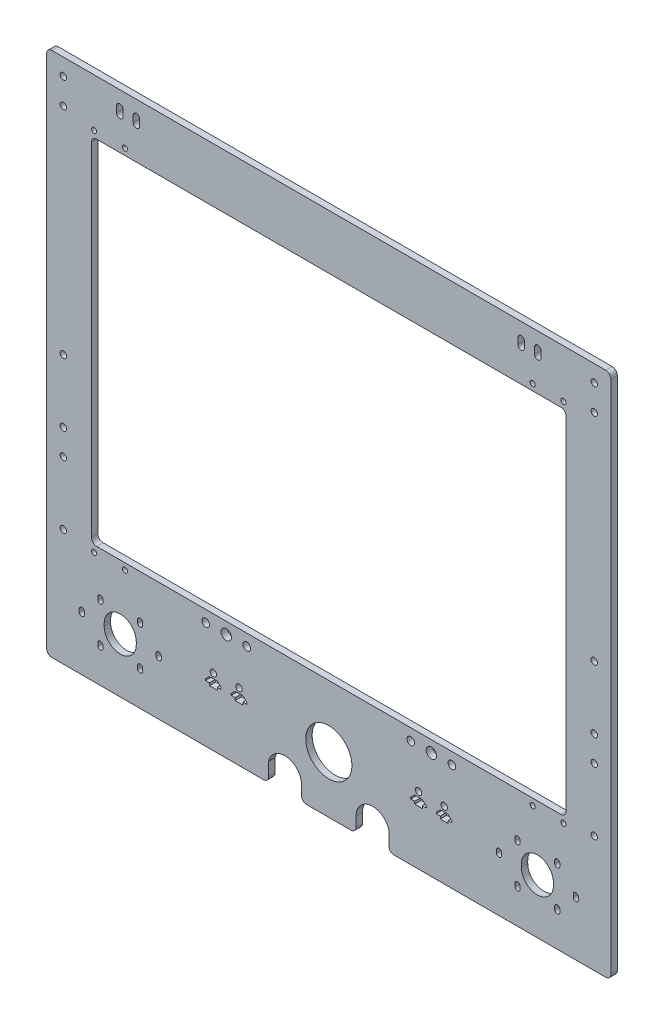
from build123d import *

# Parameters (mm, degrees)
SKETCH1_R           = 2.5
SKETCH1_R_2         = 18
SKETCH1_R_3         = 4.05
SKETCH1_R_4         = 3
SKETCH1_R_5         = 2
SKETCH1_R_6         = 12.5
BOSS_EXTRUDE1_DEPTH = 5
CUT_EXTRUDE1_DEPTH  = 14
CUT_EXTRUDE2_START  = -14
CUT_EXTRUDE2_DEPTH  = 14
FILLET1_R           = 4
CUT_EXTRUDE3_DEPTH  = 10
SKETCH7_R           = 2.5
CUT_EXTRUDE4_DEPTH  = 10


with BuildPart() as part:
    # Sketch1 → Boss-Extrude1 (new body)
    with BuildSketch(Plane(origin=(0, 0, 0), x_dir=(-1, 0, 0), z_dir=(0, 0, -1))):
        with BuildLine():
            Line((317.464038659, -305.743304357), (317.464038659, 96.256695643))
            ThreePointArc((317.464038659, 96.256695643), (316.292465784, 99.085122768), (313.464038659, 100.256695643))
            Line((313.464038659, 100.256695643), (-118.535961341, 100.256695643))
            ThreePointArc((-118.535961341, 100.256695643), (-121.364388466, 99.085122768), (-122.535961341, 96.256695643))
            Line((-122.535961341, 96.256695643), (-122.535961341, -305.743304357))
            ThreePointArc((-122.535961341, -305.743304357), (-121.364388466, -308.571731482), (-118.535961341, -309.743304357))
            Line((-118.535961341, -309.743304357), (313.464038659, -309.743304357))
            ThreePointArc((313.464038659, -309.743304357), (316.292465784, -308.571731482), (317.464038659, -305.743304357))
        make_face()
        with Locations(Location((304.464038659, 87.256695643, 0), (0, 0, 180))):
            Circle(SKETCH1_R, mode=Mode.SUBTRACT)
        with Locations(Location((304.464038659, 67.256695643, 0), (0, 0, 180))):
            Circle(SKETCH1_R, mode=Mode.SUBTRACT)
        with Locations(Location((304.464038659, -149.743304357, 0), (0, 0, 180))):
            Circle(SKETCH1_R, mode=Mode.SUBTRACT)
        with Locations(Location((304.464038659, -169.743304357, 0), (0, 0, 180))):
            Circle(SKETCH1_R, mode=Mode.SUBTRACT)
        with Locations(Location((-109.535961341, 87.256695643, 0), (0, 0, 180))):
            Circle(SKETCH1_R, mode=Mode.SUBTRACT)
        with Locations(Location((-109.535961341, 67.256695643, 0), (0, 0, 180))):
            Circle(SKETCH1_R, mode=Mode.SUBTRACT)
        with Locations(Location((-109.535961341, -149.743304357, 0), (0, 0, 180))):
            Circle(SKETCH1_R, mode=Mode.SUBTRACT)
        with Locations(Location((-109.535961341, -169.743304357, 0), (0, 0, 180))):
            Circle(SKETCH1_R, mode=Mode.SUBTRACT)
        with Locations(Location((7.464038659, -257.243304357, 0), (0, 0, 180))):
            Circle(SKETCH1_R, mode=Mode.SUBTRACT)
        with Locations(Location((27.464038659, -257.243304357, 0), (0, 0, 180))):
            Circle(SKETCH1_R, mode=Mode.SUBTRACT)
        with Locations(Location((167.464038659, -257.243304357, 0), (0, 0, 180))):
            Circle(SKETCH1_R, mode=Mode.SUBTRACT)
        with Locations(Location((187.464038659, -257.243304357, 0), (0, 0, 180))):
            Circle(SKETCH1_R, mode=Mode.SUBTRACT)
        with Locations(Location((97.464038659, -265.743304357, 0), (0, 0, 180))):
            Circle(SKETCH1_R_2, mode=Mode.SUBTRACT)
        with Locations(Location((17.464038659, -226.243304357, 0), (0, 0, 180))):
            Circle(SKETCH1_R_3, mode=Mode.SUBTRACT)
        with Locations(Location((161.464038659, -226.243304357, 0), (0, 0, 180))):
            Circle(SKETCH1_R_4, mode=Mode.SUBTRACT)
        with Locations(Location((33.464038659, -226.243304357, 0), (0, 0, 180))):
            Circle(SKETCH1_R_4, mode=Mode.SUBTRACT)
        with Locations(Location((1.464038659, -226.243304357, 0), (0, 0, 180))):
            Circle(SKETCH1_R_4, mode=Mode.SUBTRACT)
        with Locations(Location((177.464038659, -226.243304357, 0), (0, 0, 180))):
            Circle(SKETCH1_R_3, mode=Mode.SUBTRACT)
        with Locations(Location((193.464038659, -226.243304357, 0), (0, 0, 180))):
            Circle(SKETCH1_R_4, mode=Mode.SUBTRACT)
        with Locations(Location((-85.535961341, 62.756695643, 0), (0, 0, 180))):
            Circle(SKETCH1_R_5, mode=Mode.SUBTRACT)
        with Locations(Location((-61.535961341, 62.756695643, 0), (0, 0, 180))):
            Circle(SKETCH1_R_5, mode=Mode.SUBTRACT)
        with Locations(Location((256.464038659, 62.756695643, 0), (0, 0, 180))):
            Circle(SKETCH1_R_5, mode=Mode.SUBTRACT)
        with Locations(Location((280.464038659, 62.756695643, 0), (0, 0, 180))):
            Circle(SKETCH1_R_5, mode=Mode.SUBTRACT)
        with Locations(Location((-85.535961341, -222.243304357, 0), (0, 0, 180))):
            Circle(SKETCH1_R_5, mode=Mode.SUBTRACT)
        with Locations(Location((-61.535961341, -222.243304357, 0), (0, 0, 180))):
            Circle(SKETCH1_R_5, mode=Mode.SUBTRACT)
        with Locations(Location((256.464038659, -222.243304357, 0), (0, 0, 180))):
            Circle(SKETCH1_R_5, mode=Mode.SUBTRACT)
        with Locations(Location((280.464038659, -222.243304357, 0), (0, 0, 180))):
            Circle(SKETCH1_R_5, mode=Mode.SUBTRACT)
        with Locations(Location((-65.185961341, -266.243304357, 0), (0, 0, 180))):
            Circle(SKETCH1_R_6, mode=Mode.SUBTRACT)
        with Locations(Location((-80.685961341, -250.743304357, 0), (0, 0, 180))):
            Circle(SKETCH1_R_5, mode=Mode.SUBTRACT)
        with Locations(Location((-49.685961341, -250.743304357, 0), (0, 0, 180))):
            Circle(SKETCH1_R_5, mode=Mode.SUBTRACT)
        with Locations(Location((-49.685961341, -281.743304357, 0), (0, 0, 180))):
            Circle(SKETCH1_R_5, mode=Mode.SUBTRACT)
        with Locations(Location((-80.685961341, -281.743304357, 0), (0, 0, 180))):
            Circle(SKETCH1_R_5, mode=Mode.SUBTRACT)
        with Locations((290.114038659, -266.243304357)):
            Circle(SKETCH1_R_5, mode=Mode.SUBTRACT)
        with Locations((230.114038659, -266.243304357)):
            Circle(SKETCH1_R_5, mode=Mode.SUBTRACT)
        with Locations((275.614038659, -281.743304357)):
            Circle(SKETCH1_R_5, mode=Mode.SUBTRACT)
        with Locations((244.614038659, -281.743304357)):
            Circle(SKETCH1_R_5, mode=Mode.SUBTRACT)
        with Locations((244.614038659, -250.743304357)):
            Circle(SKETCH1_R_5, mode=Mode.SUBTRACT)
        with Locations(Location((-35.185961341, -266.243304357, 0), (0, 0, 180))):
            Circle(SKETCH1_R_5, mode=Mode.SUBTRACT)
        with Locations(Location((-95.185961341, -266.243304357, 0), (0, 0, 180))):
            Circle(SKETCH1_R_5, mode=Mode.SUBTRACT)
        with Locations((275.614038659, -250.743304357)):
            Circle(SKETCH1_R_5, mode=Mode.SUBTRACT)
        with Locations((260.114038659, -266.243304357)):
            Circle(SKETCH1_R_6, mode=Mode.SUBTRACT)
        with BuildLine():
            Line((-83.535961341, 57.756695643), (278.464038659, 57.756695643))
            ThreePointArc((278.464038659, 57.756695643), (281.292465784, 56.585122768), (282.464038659, 53.756695643))
            Line((282.464038659, 53.756695643), (282.464038659, -213.243304357))
            ThreePointArc((282.464038659, -213.243304357), (281.292465784, -216.071731482), (278.464038659, -217.243304357))
            Line((278.464038659, -217.243304357), (-83.535961341, -217.243304357))
            ThreePointArc((-83.535961341, -217.243304357), (-86.364388466, -216.071731482), (-87.535961341, -213.243304357))
            Line((-87.535961341, -213.243304357), (-87.535961341, 53.756695643))
            ThreePointArc((-87.535961341, 53.756695643), (-86.364388466, 56.585122768), (-83.535961341, 57.756695643))
        make_face(mode=Mode.SUBTRACT)
        with BuildLine():
            Line((-68.035961341, 85.756695643), (-68.035961341, 88.256695643))
            ThreePointArc((-68.035961341, 88.256695643), (-65.535961341, 90.756695643), (-63.035961341, 88.256695643))
            Line((-63.035961341, 88.256695643), (-63.035961341, 85.756695643))
            Line((-63.035961341, 85.756695643), (-63.035961341, 83.256695643))
            ThreePointArc((-63.035961341, 83.256695643), (-65.535961341, 80.756695643), (-68.035961341, 83.256695643))
            Line((-68.035961341, 83.256695643), (-68.035961341, 85.756695643))
        make_face(mode=Mode.SUBTRACT)
        with BuildLine():
            Line((-55.035961341, 85.756695643), (-55.035961341, 88.256695643))
            ThreePointArc((-55.035961341, 88.256695643), (-52.535961341, 90.756695643), (-50.035961341, 88.256695643))
            Line((-50.035961341, 88.256695643), (-50.035961341, 85.756695643))
            Line((-50.035961341, 85.756695643), (-50.035961341, 83.256695643))
            ThreePointArc((-50.035961341, 83.256695643), (-52.535961341, 80.756695643), (-55.035961341, 83.256695643))
            Line((-55.035961341, 83.256695643), (-55.035961341, 85.756695643))
        make_face(mode=Mode.SUBTRACT)
        with BuildLine():
            Line((244.964038659, 85.756695643), (244.964038659, 88.256695643))
            ThreePointArc((244.964038659, 88.256695643), (247.464038659, 90.756695643), (249.964038659, 88.256695643))
            Line((249.964038659, 88.256695643), (249.964038659, 85.756695643))
            Line((249.964038659, 85.756695643), (249.964038659, 83.256695643))
            ThreePointArc((249.964038659, 83.256695643), (247.464038659, 80.756695643), (244.964038659, 83.256695643))
            Line((244.964038659, 83.256695643), (244.964038659, 85.756695643))
        make_face(mode=Mode.SUBTRACT)
        with BuildLine():
            Line((257.964038659, 85.756695643), (257.964038659, 88.256695643))
            ThreePointArc((257.964038659, 88.256695643), (260.464038659, 90.756695643), (262.964038659, 88.256695643))
            Line((262.964038659, 88.256695643), (262.964038659, 85.756695643))
            Line((262.964038659, 85.756695643), (262.964038659, 83.256695643))
            ThreePointArc((262.964038659, 83.256695643), (260.464038659, 80.756695643), (257.964038659, 83.256695643))
            Line((257.964038659, 83.256695643), (257.964038659, 85.756695643))
        make_face(mode=Mode.SUBTRACT)
    extrude(amount=-BOSS_EXTRUDE1_DEPTH)

    # Sketch4 → Cut-Extrude1 (cut)
    with BuildSketch(Plane.XY.offset(5)):
        with BuildLine():
            Line((-76.214038659, -298.193304357), (-76.214038659, -309.743304357))
            Line((-76.214038659, -309.743304357), (-50.546953115, -309.743304357))
            Line((-50.546953115, -309.743304357), (-50.546953115, -295.27013077))
            ThreePointArc((-50.546953115, -295.27013077), (-64.685073656, -285.276801114), (-76.214038659, -298.193304357))
        make_face()
        with BuildLine():
            Line((-144.381124203, -295.27013077), (-144.381124203, -309.743304357))
            Line((-144.381124203, -309.743304357), (-118.714038659, -309.743304357))
            Line((-118.714038659, -309.743304357), (-118.714038659, -298.193304357))
            ThreePointArc((-118.714038659, -298.193304357), (-130.243003661, -285.276801114), (-144.381124203, -295.27013077))
        make_face()
    extrude(amount=-CUT_EXTRUDE1_DEPTH, mode=Mode.SUBTRACT)

    # Sketch5 → Cut-Extrude2 (cut)
    with BuildSketch(Plane.XY.offset(5).offset(CUT_EXTRUDE2_START)):
        with BuildLine():
            Line((-273.614038659, -250.743304357), (-273.614038659, -252.743304357))
            ThreePointArc((-273.614038659, -252.743304357), (-275.614038659, -254.743304357), (-277.614038659, -252.743304357))
            Line((-277.614038659, -252.743304357), (-277.614038659, -250.743304357))
            ThreePointArc((-277.614038659, -250.743304357), (-275.614038659, -248.743304357), (-273.614038659, -250.743304357))
        make_face()
        with BuildLine():
            Line((-247.614038659, -266.243304357), (-247.614038659, -268.243304357))
            ThreePointArc((-247.614038659, -268.243304357), (-260.114038659, -280.743304357), (-272.614038659, -268.243304357))
            Line((-272.614038659, -268.243304357), (-272.614038659, -266.243304357))
            ThreePointArc((-272.614038659, -266.243304357), (-260.114038659, -253.743304357), (-247.614038659, -266.243304357))
        make_face()
        with BuildLine():
            Line((-288.114038659, -266.243304357), (-288.114038659, -268.243304357))
            ThreePointArc((-288.114038659, -268.243304357), (-290.114038659, -270.243304357), (-292.114038659, -268.243304357))
            Line((-292.114038659, -268.243304357), (-292.114038659, -266.243304357))
            ThreePointArc((-292.114038659, -266.243304357), (-290.114038659, -264.243304357), (-288.114038659, -266.243304357))
        make_face()
        with BuildLine():
            Line((-273.614038659, -281.743304357), (-273.614038659, -283.743304357))
            ThreePointArc((-273.614038659, -283.743304357), (-275.614038659, -285.743304357), (-277.614038659, -283.743304357))
            Line((-277.614038659, -283.743304357), (-277.614038659, -281.743304357))
            ThreePointArc((-277.614038659, -281.743304357), (-275.614038659, -279.743304357), (-273.614038659, -281.743304357))
        make_face()
        with BuildLine():
            Line((-242.614038659, -281.743304357), (-242.614038659, -283.743304357))
            ThreePointArc((-242.614038659, -283.743304357), (-244.614038659, -285.743304357), (-246.614038659, -283.743304357))
            Line((-246.614038659, -283.743304357), (-246.614038659, -281.743304357))
            ThreePointArc((-246.614038659, -281.743304357), (-244.614038659, -279.743304357), (-242.614038659, -281.743304357))
        make_face()
        with BuildLine():
            Line((-228.114038659, -266.243304357), (-228.114038659, -268.243304357))
            ThreePointArc((-228.114038659, -268.243304357), (-230.114038659, -270.243304357), (-232.114038659, -268.243304357))
            Line((-232.114038659, -268.243304357), (-232.114038659, -266.243304357))
            ThreePointArc((-232.114038659, -266.243304357), (-230.114038659, -264.243304357), (-228.114038659, -266.243304357))
        make_face()
        with BuildLine():
            Line((-242.614038659, -250.743304357), (-242.614038659, -252.743304357))
            ThreePointArc((-242.614038659, -252.743304357), (-244.614038659, -254.743304357), (-246.614038659, -252.743304357))
            Line((-246.614038659, -252.743304357), (-246.614038659, -250.743304357))
            ThreePointArc((-246.614038659, -250.743304357), (-244.614038659, -248.743304357), (-242.614038659, -250.743304357))
        make_face()
    cut_extrude2 = extrude(amount=CUT_EXTRUDE2_DEPTH, mode=Mode.SUBTRACT)

    # Mirror1: Cut-Extrude2 across plane
    add(cut_extrude2.mirror(Plane(origin=(-97.464038659, 0, 0), x_dir=(0, 0, 1), z_dir=(1, 0, 0))), mode=Mode.SUBTRACT)

    # Fillet1
    fillet1_edges = [part.edges().sort_by_distance(p)[0] for p in [
        (-50.546953115, -309.743304357, 2.5),
        (-76.214038659, -309.743304357, 2.5),
        (-118.714038659, -309.743304357, 2.5),
        (-144.381124203, -309.743304357, 2.5),
    ]]
    fillet(fillet1_edges, radius=FILLET1_R)

    # Sketch6 → Cut-Extrude3 (cut)
    with BuildSketch(Plane(origin=(0, 0, 0), x_dir=(-1, 0, 0), z_dir=(0, 0, -1))):
        Polygon((13.575126395, -264.201883001), (10.516548209, -261.143304816), (4.433867104, -261.143237509), (1.375126395, -264.20188208), (1.375126395, -265.343304357), (4.433867104, -265.343304357), (4.433867104, -267.343304357), (10.516548209, -267.343304357), (10.516548209, -265.343304357), (13.575126395, -265.343304357), align=None)
        Polygon((33.575126395, -264.201883001), (30.516548209, -261.143304816), (24.433867104, -261.143237509), (21.375126395, -264.20188208), (21.375126395, -265.343304357), (24.433867104, -265.343304357), (24.433867104, -267.343304357), (30.516548209, -267.343304357), (30.516548209, -265.343304357), (33.575126395, -265.343304357), align=None)
        Polygon((173.575126395, -264.201883001), (170.516548209, -261.143304816), (164.433867104, -261.143237509), (161.375126395, -264.20188208), (161.375126395, -265.343304357), (164.433867104, -265.343304357), (164.433867104, -267.343304357), (170.516548209, -267.343304357), (170.516548209, -265.343304357), (173.575126395, -265.343304357), align=None)
        Polygon((193.575126395, -264.201883001), (190.516548209, -261.143304816), (184.433867104, -261.143237509), (181.375126395, -264.20188208), (181.375126395, -265.343304357), (184.433867104, -265.343304357), (184.433867104, -267.343304357), (190.516548209, -267.343304357), (190.516548209, -265.343304357), (193.575126395, -265.343304357), align=None)
    extrude(amount=-CUT_EXTRUDE3_DEPTH, mode=Mode.SUBTRACT)

    # Sketch7 → Cut-Extrude4 (cut)
    with BuildSketch(Plane(origin=(0, 0, 0), x_dir=(-1, 0, 0), z_dir=(0, 0, -1))):
        with Locations((-109.535961341, -100.743304357)):
            Circle(SKETCH7_R)
        with Locations((-109.535961341, -218.743304357)):
            Circle(SKETCH7_R)
        with Locations((304.464038659, -218.743304357)):
            Circle(SKETCH7_R)
        with Locations((304.464038659, -100.743304357)):
            Circle(SKETCH7_R)
    extrude(amount=-CUT_EXTRUDE4_DEPTH, mode=Mode.SUBTRACT)


solid = part.part
